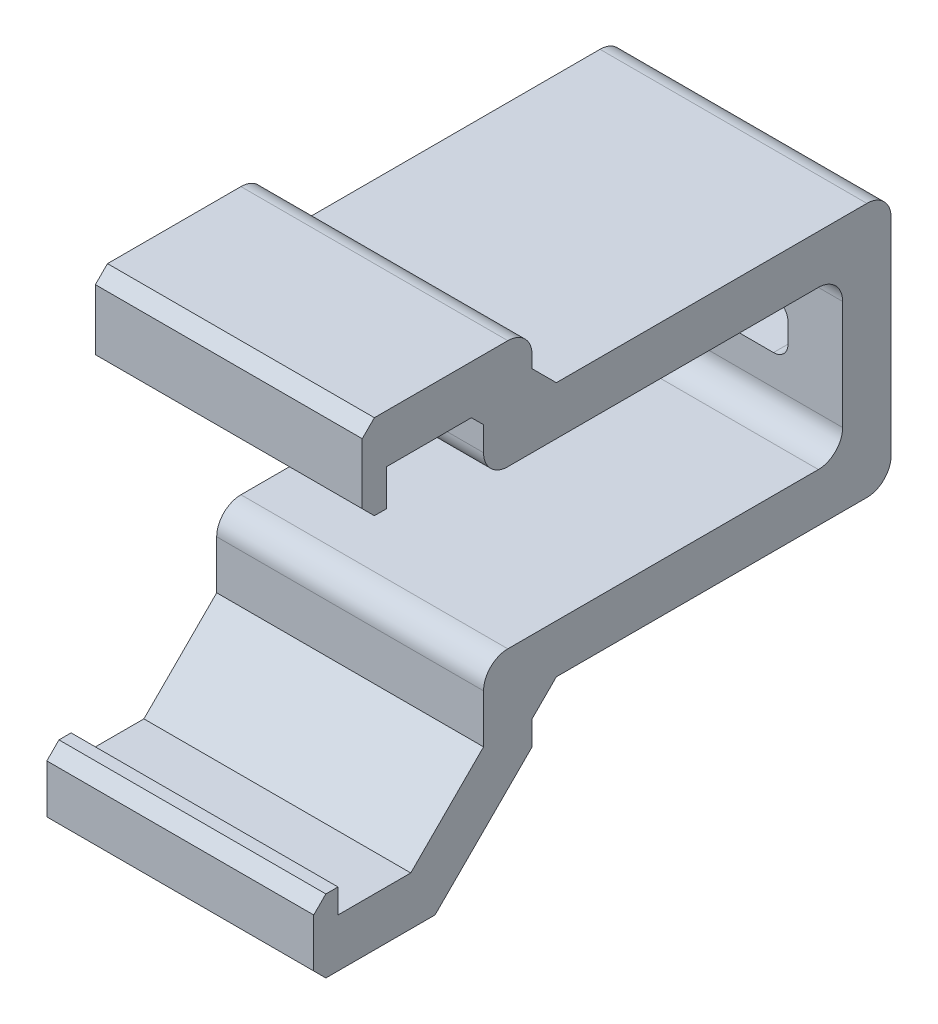
from build123d import *

# Parameters (mm, degrees)
BOSS_EXTRUDE1_DEPTH = 11
SKETCH2_W           = 6.5
SKETCH2_H           = 2
CUT_EXTRUDE1_DEPTH  = 11
SKETCH3_W           = 11
SKETCH3_H           = 2
BOSS_EXTRUDE2_DEPTH = 2.5
SKETCH4_W           = 7.103618525
SKETCH4_H           = 2.480120743
CUT_EXTRUDE2_DEPTH  = 32.5
SKETCH5_W           = 11
SKETCH5_H           = 2
BOSS_EXTRUDE3_DEPTH = 5
SKETCH6_W           = 11
SKETCH6_H           = 1
BOSS_EXTRUDE4_DEPTH = 1.5
CHAMFER1_SIZE       = 0.5
SKETCH7_W           = 11
SKETCH7_H           = 2
BOSS_EXTRUDE5_DEPTH = 6
SKETCH8_W           = 9.245207015
SKETCH8_H           = 4.24468792
CUT_EXTRUDE3_DEPTH  = 26
SKETCH9_W           = 11
SKETCH9_H           = 2
BOSS_EXTRUDE6_DEPTH = 7
SKETCH10_W          = 11
SKETCH10_H          = 1
BOSS_EXTRUDE7_DEPTH = 1
CHAMFER2_SIZE       = 0.5
FILLET1_R           = 1
CHAMFER3_SIZE       = 0.5
CHAMFER4_SIZE       = 1
SKETCH11_W          = 2.25
SKETCH11_H          = 2
CUT_EXTRUDE4_DEPTH  = 10
FILLET2_R           = 0.6
CHAMFER5_SIZE       = 3
CHAMFER6_SIZE       = 4
CHAMFER7_SIZE       = 0.5


with BuildPart() as part:
    # Sketch1 → Boss-Extrude1 (new body)
    with BuildSketch(Plane(origin=(0, 0, 0), x_dir=(0, 0, -1), z_dir=(1, 0, 0))):
        with BuildLine():
            Line((-12.25399361, 3.177316294), (-12.25399361, 5.177316294))
            Line((-12.25399361, 5.177316294), (8.74600639, 5.177316294))
            ThreePointArc((8.74600639, 5.177316294), (9.453113171, 4.884423075), (9.74600639, 4.177316294))
            Line((9.74600639, 4.177316294), (9.74600639, -4.322683706))
            ThreePointArc((9.74600639, -4.322683706), (9.453113171, -5.029790487), (8.74600639, -5.322683706))
            Line((8.74600639, -5.322683706), (-12.25399361, -5.322683706))
            Line((-12.25399361, -5.322683706), (-12.25399361, -3.322683706))
            Line((-12.25399361, -3.322683706), (6.74600639, -3.322683706))
            ThreePointArc((6.74600639, -3.322683706), (7.453113171, -3.029790487), (7.74600639, -2.322683706))
            Line((7.74600639, -2.322683706), (7.74600639, 2.177316294))
            ThreePointArc((7.74600639, 2.177316294), (7.453113171, 2.884423075), (6.74600639, 3.177316294))
            Line((6.74600639, 3.177316294), (-12.25399361, 3.177316294))
        make_face()
    extrude(amount=BOSS_EXTRUDE1_DEPTH)

    # Sketch2 → Cut-Extrude1 (cut)
    with BuildSketch(Plane.XY.offset(-7.74600639)):
        with Locations((5.5, -0.072683706)):
            Rectangle(SKETCH2_W, SKETCH2_H)
    extrude(amount=-CUT_EXTRUDE1_DEPTH, mode=Mode.SUBTRACT)

    # Sketch3 → Boss-Extrude2 (add)
    with BuildSketch(Plane(origin=(0, 5.177316294, 0), x_dir=(1, 0, 0), z_dir=(0, 1, 0))):
        with Locations((5.5, -6.05399361)):
            Rectangle(SKETCH3_W, SKETCH3_H)
    extrude(amount=BOSS_EXTRUDE2_DEPTH)

    # Sketch4 → Cut-Extrude2 (cut)
    with BuildSketch(Plane.ZY):
        with Locations((10.605802872, 3.937255923)):
            Rectangle(SKETCH4_W, SKETCH4_H)
    extrude(amount=-CUT_EXTRUDE2_DEPTH, mode=Mode.SUBTRACT)

    # Sketch5 → Boss-Extrude3 (add)
    with BuildSketch(Plane.XY.offset(7.05399361)):
        with Locations((5.5, 6.677316294)):
            Rectangle(SKETCH5_W, SKETCH5_H)
    extrude(amount=BOSS_EXTRUDE3_DEPTH)

    # Sketch6 → Boss-Extrude4 (add)
    with BuildSketch(Plane.XZ.offset(-5.677316294)):
        with Locations((5.5, 11.55399361)):
            Rectangle(SKETCH6_W, SKETCH6_H)
    extrude(amount=BOSS_EXTRUDE4_DEPTH)

    # Chamfer1
    chamfer1_edges = [part.edges().sort_by_distance(p)[0] for p in [
        (5.5, 4.177316294, 12.05399361),
    ]]
    chamfer(chamfer1_edges, length=CHAMFER1_SIZE)

    # Sketch7 → Boss-Extrude5 (add)
    with BuildSketch(Plane.XZ.offset(5.322683706)):
        with Locations((5.5, 6.05399361)):
            Rectangle(SKETCH7_W, SKETCH7_H)
    extrude(amount=BOSS_EXTRUDE5_DEPTH)

    # Sketch8 → Cut-Extrude3 (cut)
    with BuildSketch(Plane(origin=(11, 0, 0), x_dir=(0, 0, -1), z_dir=(1, 0, 0))):
        with Locations((-11.676597118, -3.200339746)):
            Rectangle(SKETCH8_W, SKETCH8_H)
    extrude(amount=-CUT_EXTRUDE3_DEPTH, mode=Mode.SUBTRACT)

    # Sketch9 → Boss-Extrude6 (add)
    with BuildSketch(Plane.XY.offset(7.05399361)):
        with Locations((5.5, -10.322683706)):
            Rectangle(SKETCH9_W, SKETCH9_H)
    extrude(amount=BOSS_EXTRUDE6_DEPTH)

    # Sketch10 → Boss-Extrude7 (add)
    with BuildSketch(Plane(origin=(0, -9.322683706, 0), x_dir=(1, 0, 0), z_dir=(0, 1, 0))):
        with Locations((5.5, -13.55399361)):
            Rectangle(SKETCH10_W, SKETCH10_H)
    extrude(amount=BOSS_EXTRUDE7_DEPTH)

    # Chamfer2
    chamfer2_edges = [part.edges().sort_by_distance(p)[0] for p in [
        (5.5, -8.322683706, 14.05399361),
    ]]
    chamfer(chamfer2_edges, length=CHAMFER2_SIZE)

    # Fillet1
    fillet1_edges = [part.edges().sort_by_distance(p)[0] for p in [
        (5.5, 7.677316294, 5.05399361),
        (5.5, 3.177316294, 7.05399361),
        (5.5, -3.322683706, 7.05399361),
    ]]
    fillet(fillet1_edges, radius=FILLET1_R)

    # Chamfer3
    chamfer3_edges = [part.edges().sort_by_distance(p)[0] for p in [
        (5.5, -11.322683706, 14.05399361),
        (5.5, 7.677316294, 12.05399361),
    ]]
    chamfer(chamfer3_edges, length=CHAMFER3_SIZE)

    # Chamfer4
    chamfer4_edges = [part.edges().sort_by_distance(p)[0] for p in [
        (5.5, 5.177316294, 5.05399361),
        (5.5, -5.322683706, 5.05399361),
    ]]
    chamfer(chamfer4_edges, length=CHAMFER4_SIZE)

    # Sketch11 → Cut-Extrude4 (cut)
    with BuildSketch(Plane(origin=(0, 0, -9.74600639), x_dir=(-1, 0, 0), z_dir=(0, 0, -1))):
        with Locations((-1.125, -0.072683706)):
            Rectangle(SKETCH11_W, SKETCH11_H)
    extrude(amount=-CUT_EXTRUDE4_DEPTH, mode=Mode.SUBTRACT)

    # Fillet2
    fillet2_edges = [part.edges().sort_by_distance(p)[0] for p in [
        (8.75, 0.927316294, -8.74600639),
        (8.75, -1.072683706, -8.74600639),
    ]]
    fillet(fillet2_edges, radius=FILLET2_R)

    # Chamfer5
    chamfer5_edges = [part.edges().sort_by_distance(p)[0] for p in [
        (5.5, -9.322683706, 7.05399361),
    ]]
    chamfer(chamfer5_edges, length=CHAMFER5_SIZE)

    # Chamfer6
    chamfer6_edges = [part.edges().sort_by_distance(p)[0] for p in [
        (5.5, -11.322683706, 5.05399361),
    ]]
    chamfer(chamfer6_edges, length=CHAMFER6_SIZE)

    # Chamfer7
    chamfer7_edges = [part.edges().sort_by_distance(p)[0] for p in [
        (5.5, 5.677316294, 7.05399361),
    ]]
    chamfer(chamfer7_edges, length=CHAMFER7_SIZE)


solid = part.part
